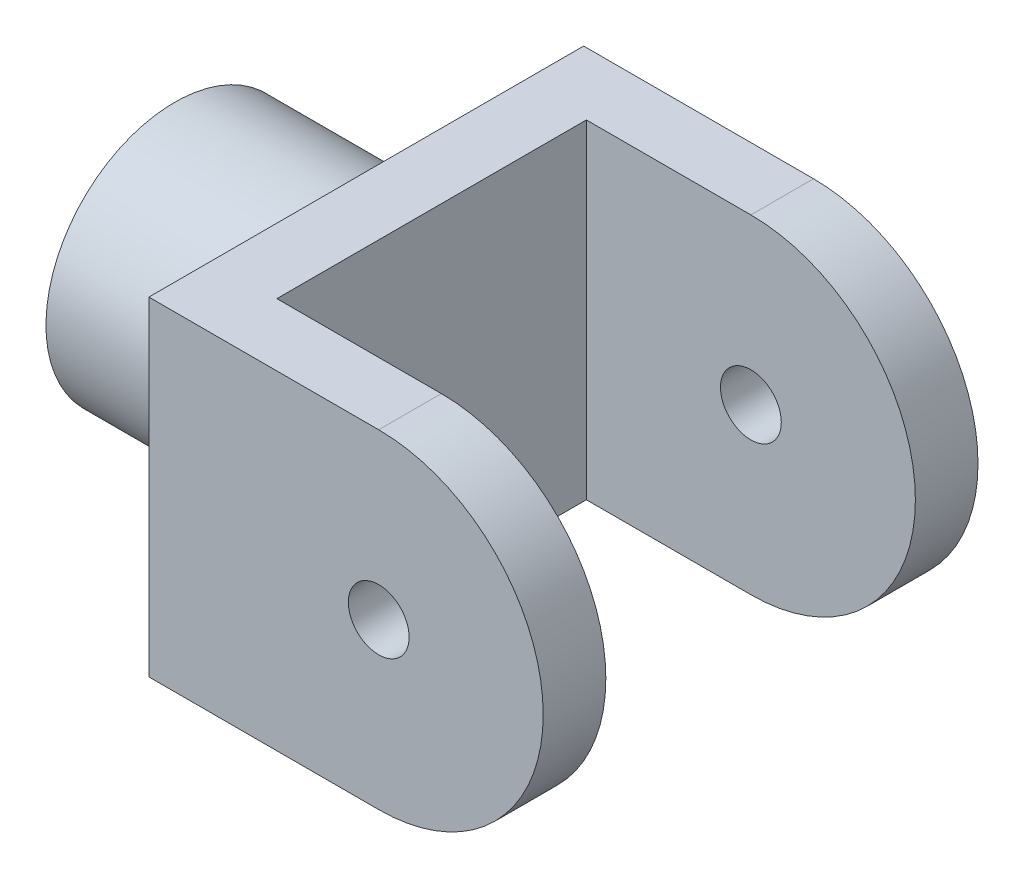
from build123d import *

# Parameters (mm, degrees)
BOSS_EXTRUDE2_DEPTH      = 11.35
BOSS_EXTRUDE2_DEPTH_BACK = 11.35
SKETCH1_R                = 1.5875
CUT_EXTRUDE1_DEPTH       = 8.08
CUT_EXTRUDE1_DEPTH_BACK  = 8.08
SKETCH3_W                = 17.175
SKETCH3_H                = 17.175
SKETCH4_R                = 6.7225
SKETCH4_R_2              = 4.7225
BOSS_EXTRUDE4_DEPTH      = 10


with BuildPart() as part:
    # Sketch1 → Boss-Extrude2 (new, two sides: drawn at the far end of the back side and taken through both)
    with BuildSketch(Plane.XY.offset(-BOSS_EXTRUDE2_DEPTH_BACK)):
        with BuildLine():
            Line((0, 8.5875), (-12, 8.5875))
            Line((-12, 8.5875), (-12, -8.5875))
            Line((-12, -8.5875), (0, -8.5875))
            ThreePointArc((0, -8.5875), (8.5875, 0), (0, 8.5875))
        make_face()
        Circle(SKETCH1_R, mode=Mode.SUBTRACT)
    extrude(amount=BOSS_EXTRUDE2_DEPTH + BOSS_EXTRUDE2_DEPTH_BACK)

    # Sketch3 → Cut-Extrude1 (cut, two sides: drawn at the far end of the back side and taken through both)
    with BuildSketch(Plane.XY.offset(-CUT_EXTRUDE1_DEPTH_BACK)):
        Rectangle(SKETCH3_W, SKETCH3_H)
    extrude(amount=CUT_EXTRUDE1_DEPTH + CUT_EXTRUDE1_DEPTH_BACK, mode=Mode.SUBTRACT)

    # Sketch4 → Boss-Extrude4 (add)
    with BuildSketch(Plane.ZY.offset(12)):
        Circle(SKETCH4_R)
        Circle(SKETCH4_R_2, mode=Mode.SUBTRACT)
    extrude(amount=BOSS_EXTRUDE4_DEPTH)


solid = part.part
